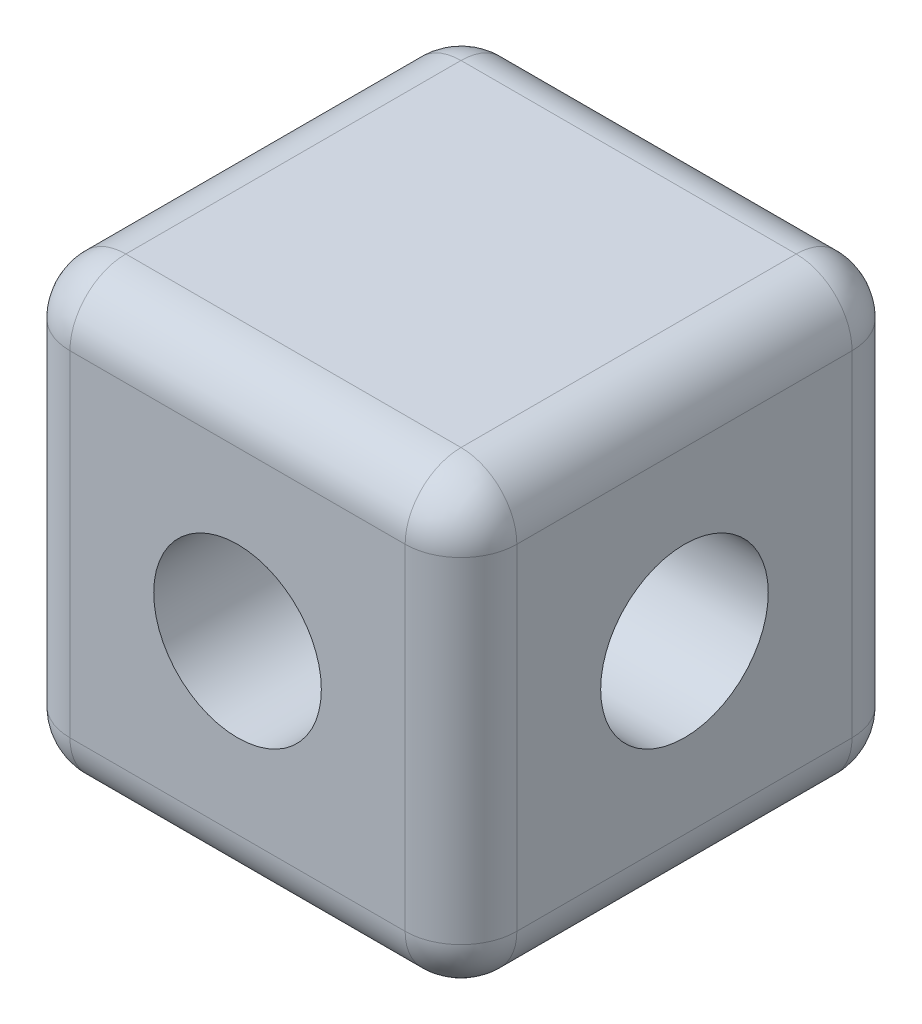
from build123d import *

# Parameters (mm, degrees)
SKETCH_1_W          = 4
SKETCH_1_H          = 4
EXTRUDE_1_DEPTH     = 4
FILLET_1_R          = 0.5
FILLET_2_R          = 0.5
FILLET_3_R          = 0.5
FILLET_4_R          = 0.5
FILLET_5_R          = 0.5
CUT_EXTRUDE_1_REACH = 8
SKETCH_2_R          = 0.75
SKETCH_3_R          = 0.75
CUT_EXTRUDE_2_DEPTH = 4


with BuildPart() as part:
    # 草图1 → 凸台-拉伸1 (new body)
    with BuildSketch(Plane(origin=(0, 0, 0), x_dir=(1, 0, 0), z_dir=(0, 1, 0))):
        Rectangle(SKETCH_1_W, SKETCH_1_H)
    extrude(amount=EXTRUDE_1_DEPTH)

    # 圆角1
    fillet_1_edges = [part.edges().sort_by_distance(p)[0] for p in [
        (0, 4, 2),
    ]]
    fillet(fillet_1_edges, radius=FILLET_1_R)

    # 圆角2
    fillet_2_edges = [part.edges().sort_by_distance(p)[0] for p in [
        (2, 4, -0.25),
        (2, 1.75, 2),
        (2, 3.853553391, 1.853553391),
    ]]
    fillet(fillet_2_edges, radius=FILLET_2_R)

    # 圆角3
    fillet_3_edges = [part.edges().sort_by_distance(p)[0] for p in [
        (-2, 4, -0.25),
        (-2, 1.75, 2),
        (-2, 3.853553391, 1.853553391),
    ]]
    fillet(fillet_3_edges, radius=FILLET_3_R)

    # 圆角4
    fillet_4_edges = [part.edges().sort_by_distance(p)[0] for p in [
        (2, 1.75, -2),
        (0, 4, -2),
        (1.853553391, 3.853553391, -2),
        (-2, 1.75, -2),
        (-1.853553391, 3.853553391, -2),
    ]]
    fillet(fillet_4_edges, radius=FILLET_4_R)

    # 圆角5
    fillet_5_edges = [part.edges().sort_by_distance(p)[0] for p in [
        (2, 0, 0),
        (1.853553391, 0, 1.853553391),
        (0, 0, 2),
        (-1.853553391, 0, 1.853553391),
        (0, 0, -2),
        (-2, 0, 0),
        (-1.853553391, 0, -1.853553391),
        (1.853553391, 0, -1.853553391),
    ]]
    fillet(fillet_5_edges, radius=FILLET_5_R)

    # 草图2 → 切除-拉伸1 (cut, up to next)
    with BuildSketch(Plane.XY.offset(2), mode=Mode.PRIVATE) as cut_extrude_1_sk1:
        with Locations((0, 2)):
            Circle(SKETCH_2_R)
    cut_extrude_1_tool1 = extrude(cut_extrude_1_sk1.sketch, amount=-CUT_EXTRUDE_1_REACH, mode=Mode.PRIVATE) & part.part
    add(cut_extrude_1_tool1.solids().sort_by_distance((0, 2, 2))[0], mode=Mode.SUBTRACT)

    # 草图3 → 切除-拉伸2 (cut)
    with BuildSketch(Plane.ZY.offset(2)):
        with Locations((0, 2)):
            Circle(SKETCH_3_R)
    extrude(amount=-CUT_EXTRUDE_2_DEPTH, mode=Mode.SUBTRACT)


solid = part.part
